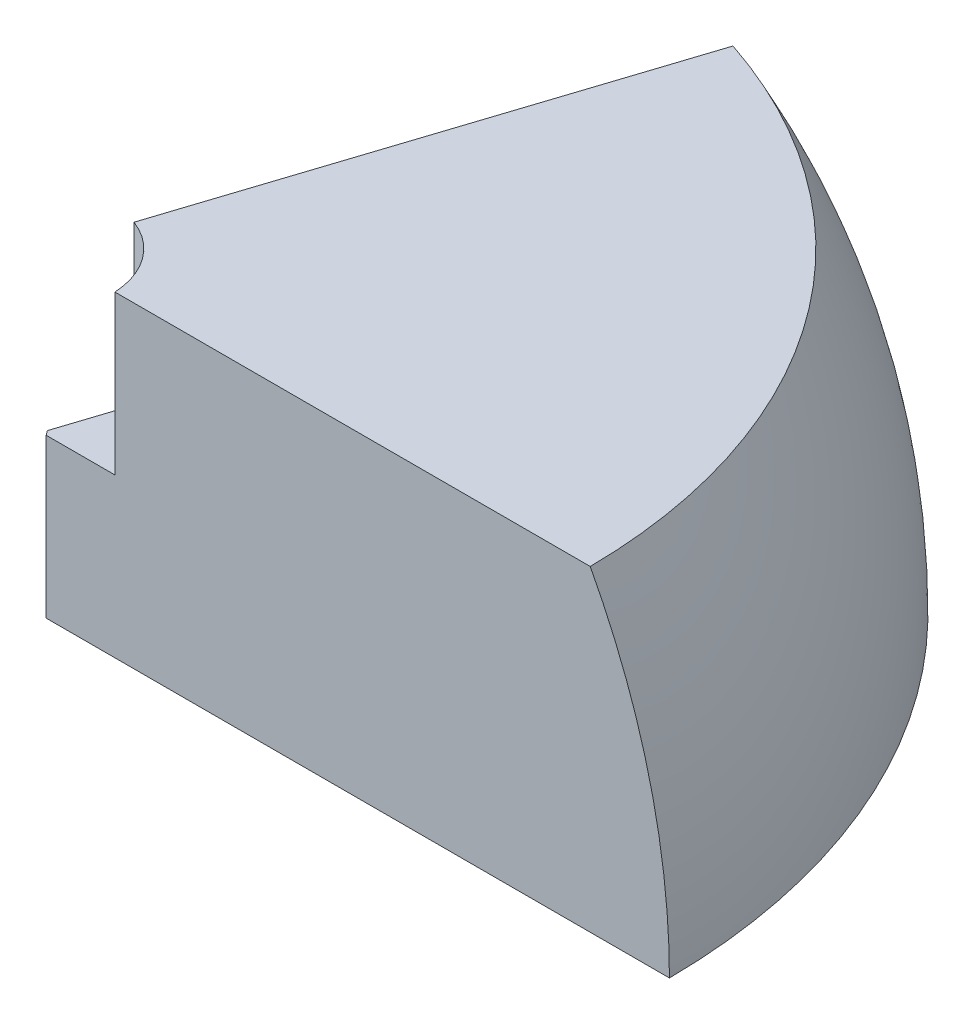
from build123d import *

# Parameters (mm, degrees)
REVOLVE1_ANGLE     = 72
CUT_EXTRUDE2_DEPTH = 0.635
CUT_EXTRUDE3_DEPTH = 0.635
SKETCH2_R          = 12.7
CUT_EXTRUDE1_DEPTH = 25.4
CUT_EXTRUDE4_REACH = 144.358


with BuildPart() as part:
    # Sketch1 → Revolve1 (revolve)
    with BuildSketch(Plane.XY):
        with BuildLine():
            Line((0, 0), (0, 50.8))
            Line((0, 50.8), (88.9, 50.8))
            ThreePointArc((88.9, 50.8), (98.376882891, 26.181720723), (101.6, 0))
            Line((101.6, 0), (0, 0))
        make_face()
    revolve(axis=Axis((0, 0, 0), (0, 1, 0)), revolution_arc=REVOLVE1_ANGLE)

    # Sketch3 → Cut-Extrude2 (cut)
    with BuildSketch(Plane(origin=(0, 0, 0), x_dir=(-0.3090169943749449, 0, 0.9510565162951544), z_dir=(-0.9510565162951544, 0, -0.3090169943749449))):
        with BuildLine():
            Line((0, 50.8), (-88.9, 50.8))
            ThreePointArc((-88.9, 50.8), (-98.376882891, 26.181720723), (-101.6, 0))
            Line((-101.6, 0), (0, 0))
            Line((0, 0), (0, 50.8))
        make_face()
    extrude(amount=-CUT_EXTRUDE2_DEPTH, mode=Mode.SUBTRACT)

    # Sketch4 → Cut-Extrude3 (cut)
    with BuildSketch(Plane.XY):
        with BuildLine():
            Line((0.667678512, 50.8), (0.667678512, 0))
            Line((0.667678512, 0), (101.6, 0))
            ThreePointArc((101.6, 0), (98.376882891, 26.181720723), (88.9, 50.8))
            Line((88.9, 50.8), (0.667678512, 50.8))
        make_face()
    extrude(amount=-CUT_EXTRUDE3_DEPTH, mode=Mode.SUBTRACT)

    # Sketch2 → Cut-Extrude1 (cut)
    with BuildSketch(Plane(origin=(0, 50.8, 0), x_dir=(1, 0, 0), z_dir=(0, 1, 0))):
        Circle(SKETCH2_R)
    extrude(amount=-CUT_EXTRUDE1_DEPTH, mode=Mode.SUBTRACT)

    # Sketch5 → Cut-Extrude4 (cut, up to next)
    with BuildSketch(Plane(origin=(0, 25.4, 0), x_dir=(1, 0, 0), z_dir=(0, 1, 0)), mode=Mode.PRIVATE) as cut_extrude4_sk1:
        Polygon((1.658905685, 0.635), (1.116550937, 1.38148727), (0.874002519, 0.635), align=None)
    cut_extrude4_tool1 = extrude(cut_extrude4_sk1.sketch, amount=-CUT_EXTRUDE4_REACH, mode=Mode.PRIVATE) & part.part
    add(cut_extrude4_tool1.solids().sort_by_distance((1.216486, 25.4, -0.883829))[0], mode=Mode.SUBTRACT)


solid = part.part
